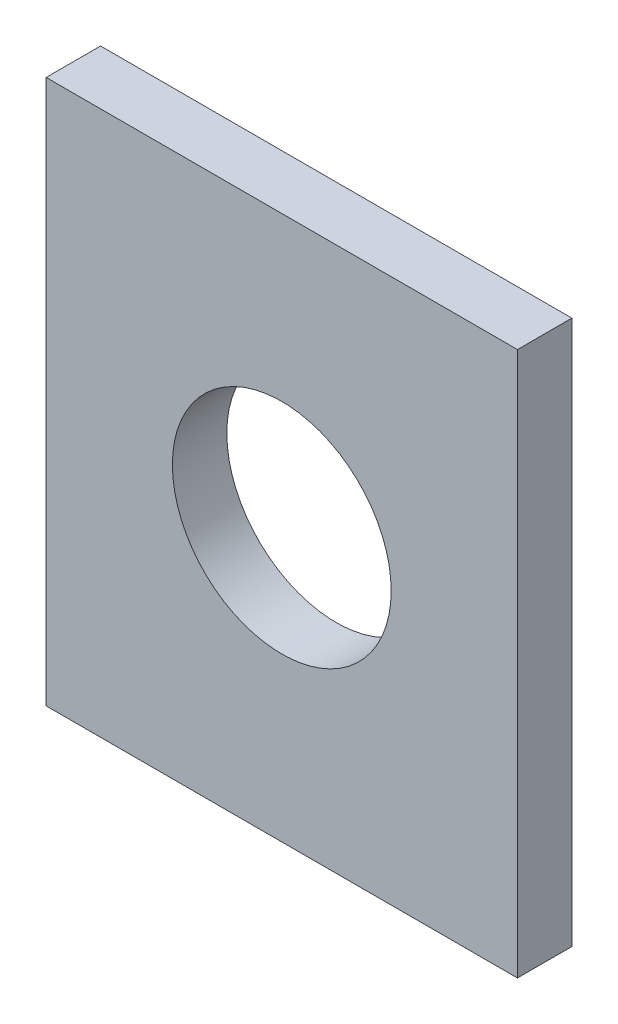
from build123d import *

# Parameters (mm, degrees)
SKETCH1_W           = 21.9964
SKETCH1_H           = 25.4
SKETCH1_R           = 5.1054
BOSS_EXTRUDE1_DEPTH = 2.54


with BuildPart() as part:
    # Sketch1 → Boss-Extrude1 (new body)
    with BuildSketch(Plane.XY):
        Rectangle(SKETCH1_W, SKETCH1_H)
        Circle(SKETCH1_R, mode=Mode.SUBTRACT)
    extrude(amount=BOSS_EXTRUDE1_DEPTH)


solid = part.part
